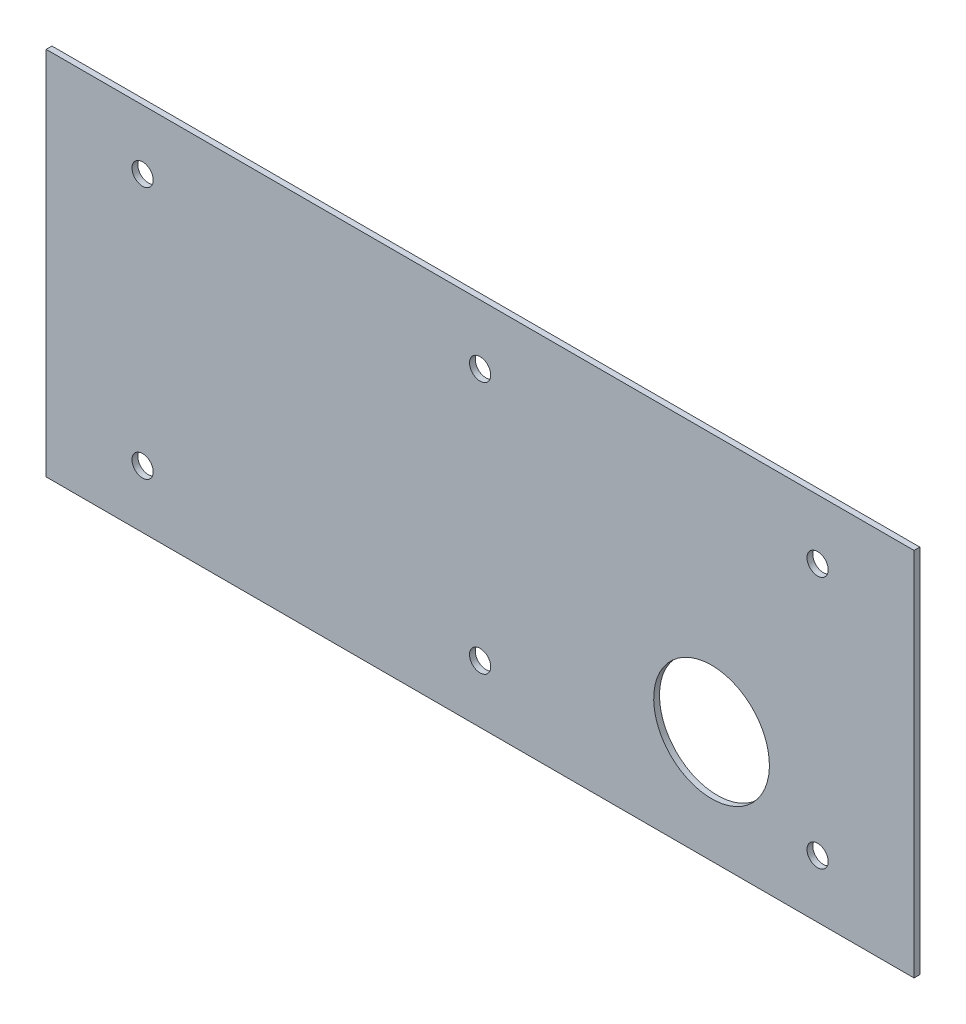
from build123d import *

# Parameters (mm, degrees)
SKETCH1_W             = 450
SKETCH1_H             = 192
BOSS_EXTRUDE1_DEPTH   = 3
SKETCH2_R             = 30
CUT_EXTRUDE1_DEPTH    = 605.559191308
M10_CLEARANCE_SLOT1_D = 11


with BuildPart() as part:
    # Sketch1 → Boss-Extrude1 (new body)
    with BuildSketch(Plane.XY):
        with Locations((160.880387918, 36.737934288)):
            Rectangle(SKETCH1_W, SKETCH1_H)
    extrude(amount=BOSS_EXTRUDE1_DEPTH)

    # Sketch2 → Cut-Extrude1 (cut, through all)
    with BuildSketch(Plane(origin=(-44.574932583, -288.564846201, -49), x_dir=(-1, 0, 0), z_dir=(0, 0, -1))):
        with Locations(Location((-325.455320501, 287.298203547, 0), (0, 0, 90))):
            Circle(SKETCH2_R)
    extrude(amount=-CUT_EXTRUDE1_DEPTH, mode=Mode.SUBTRACT)

    # M10 Clearance Slot1 (through all)
    with Locations(Plane(origin=(-44.574932583, -288.564846201, -49), x_dir=(-1, 0, 0), z_dir=(0, 0, -1))):
        with Locations((-380.455320501, 390.298203547), (-205.455320501, 390.298203547), (-30.455320501, 390.298203547), (-30.455320501, 259.298203547), (-205.455320501, 259.298203547), (-380.455320501, 259.298203547)):
            Hole(M10_CLEARANCE_SLOT1_D / 2)


solid = part.part
